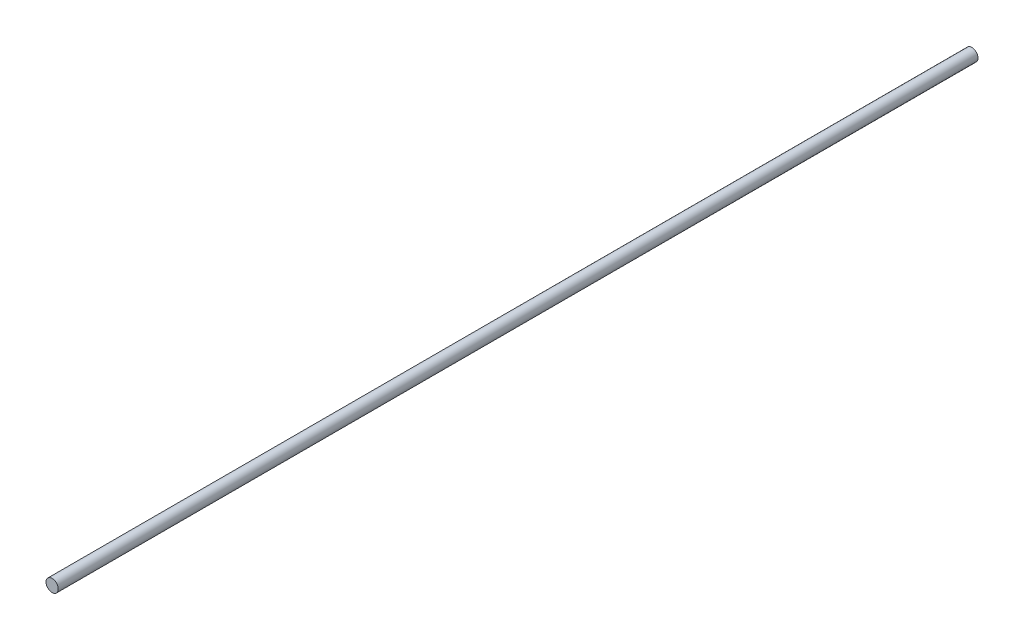
from build123d import *

# Parameters (mm, degrees)
SKETCH1_R           = 1.5875
BOSS_EXTRUDE1_DEPTH = 119.0625


with BuildPart() as part:
    # Sketch1 → Boss-Extrude1 (new, symmetric)
    with BuildSketch(Plane.XY):
        Circle(SKETCH1_R)
    extrude(amount=BOSS_EXTRUDE1_DEPTH, both=True)


solid = part.part
